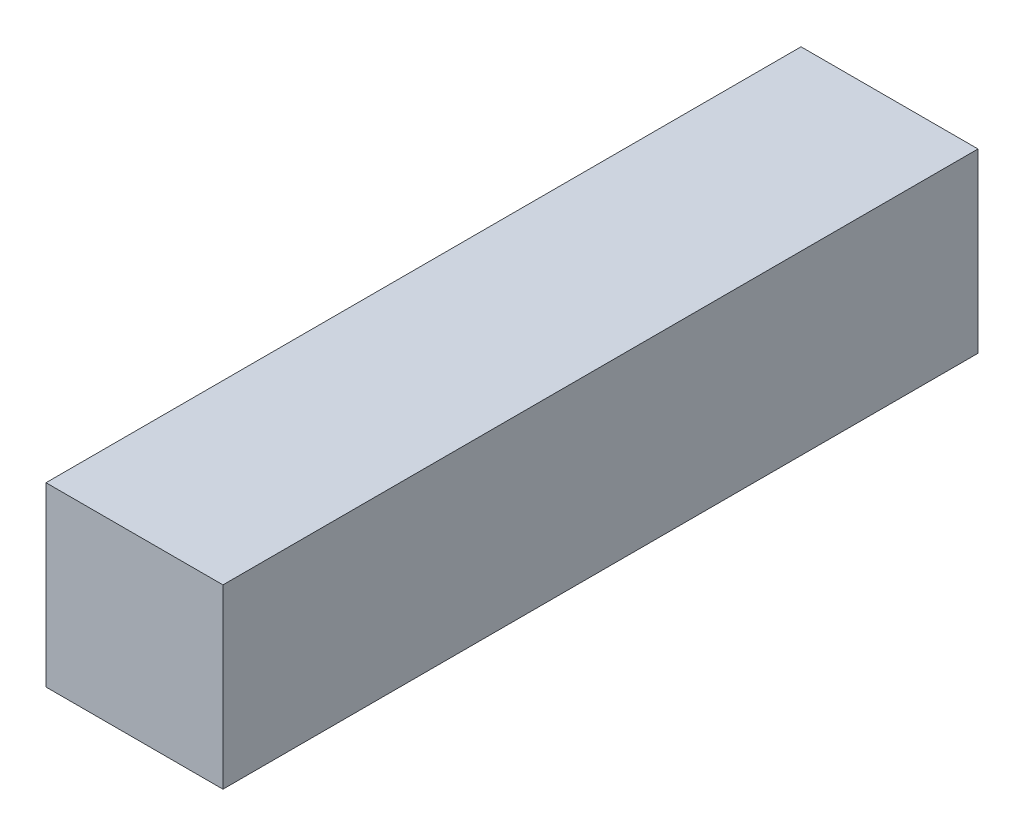
from build123d import *

# Parameters (mm, degrees)
BOSS_EXTRUDE1_DEPTH      = 152.4
BOSS_EXTRUDE1_DEPTH_BACK = 152.4
SKETCH3_W                = 2.38125
SKETCH3_H                = 2.38125
SKETCH4_R                = 8.118796588
CUT_EXTRUDE1_DEPTH       = 295.644811215


with BuildPart() as part:
    # Sketch3 → Boss-Extrude1 (new, two sides: drawn at the far end of the back side and taken through both)
    with BuildSketch(Plane.XY.offset(-BOSS_EXTRUDE1_DEPTH_BACK)):
        Rectangle(SKETCH3_W, SKETCH3_H)
    extrude(amount=BOSS_EXTRUDE1_DEPTH + BOSS_EXTRUDE1_DEPTH_BACK)

    # Sketch4 → Cut-Extrude1 (cut, through all)
    with BuildSketch(Plane.XY.offset(142.24)):
        Circle(SKETCH4_R)
    extrude(amount=-CUT_EXTRUDE1_DEPTH, mode=Mode.SUBTRACT)


solid = part.part
